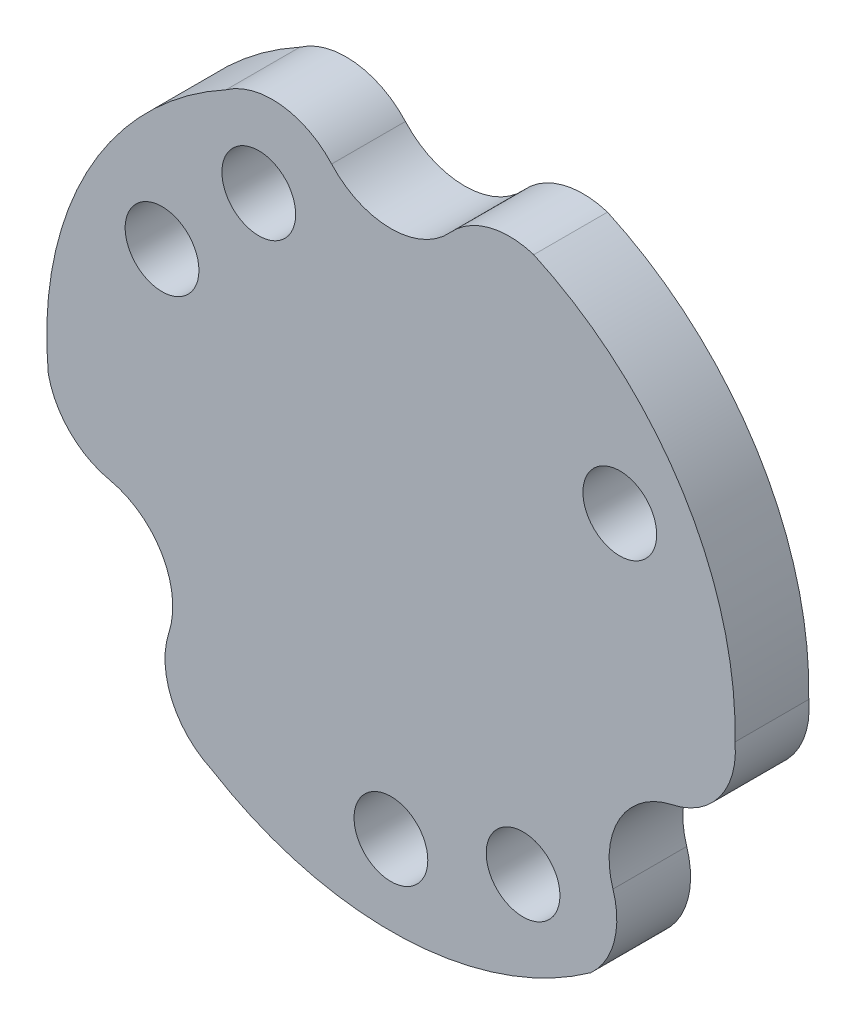
from build123d import *

# Parameters (mm, degrees)
ESQUISSE1_R        = 1.5
BOSS_EXTRU_2_DEPTH = 3


with BuildPart() as part:
    # Esquisse1 → Boss.-Extru.2 (new body)
    with BuildSketch(Plane.XY):
        with BuildLine():
            ThreePointArc((-2.411034891, 11.820685714), (0, 10.75), (2.411034891, 11.820685714))
            ThreePointArc((2.411034891, 11.820685714), (3.975330286, 12.779130538), (5.80943088, 12.737759334))
            ThreePointArc((5.80943088, 12.737759334), (11.865562564, 7.430237213), (13.995977593, -0.335575935))
            ThreePointArc((13.995977593, -0.335575935), (13.382779595, -2.564868949), (11.442531564, -3.822325392))
            ThreePointArc((11.442531564, -3.822325392), (9.309773091, -5.375), (9.031496673, -7.998360322))
            ThreePointArc((9.031496673, -7.998360322), (9.079386541, -9.832302285), (8.126507731, -11.399994391))
            ThreePointArc((8.126507731, -11.399994391), (0.5019929, -13.990997217), (-7.288606081, -11.953084179))
            ThreePointArc((-7.288606081, -11.953084179), (-8.912631465, -10.307392628), (-9.031496673, -7.998360322))
            ThreePointArc((-9.031496673, -7.998360322), (-9.309773091, -5.375), (-11.442531564, -3.822325392))
            ThreePointArc((-11.442531564, -3.822325392), (-13.054716827, -2.946828253), (-13.935938611, -1.337764944))
            ThreePointArc((-13.935938611, -1.337764944), (-12.367555464, 6.560760004), (-6.707371512, 12.288660114))
            ThreePointArc((-6.707371512, 12.288660114), (-4.47014813, 12.872261577), (-2.411034891, 11.820685714))
        make_face()
        with Locations((9.309773091, 5.375)):
            Circle(ESQUISSE1_R, mode=Mode.SUBTRACT)
        with Locations((0, -10.75)):
            Circle(ESQUISSE1_R, mode=Mode.SUBTRACT)
        with Locations((-9.309773091, 5.375)):
            Circle(ESQUISSE1_R, mode=Mode.SUBTRACT)
        with Locations((5.375, -9.309773091)):
            Circle(ESQUISSE1_R, mode=Mode.SUBTRACT)
        with Locations((-5.375, 9.309773091)):
            Circle(ESQUISSE1_R, mode=Mode.SUBTRACT)
    extrude(amount=BOSS_EXTRU_2_DEPTH)


solid = part.part
